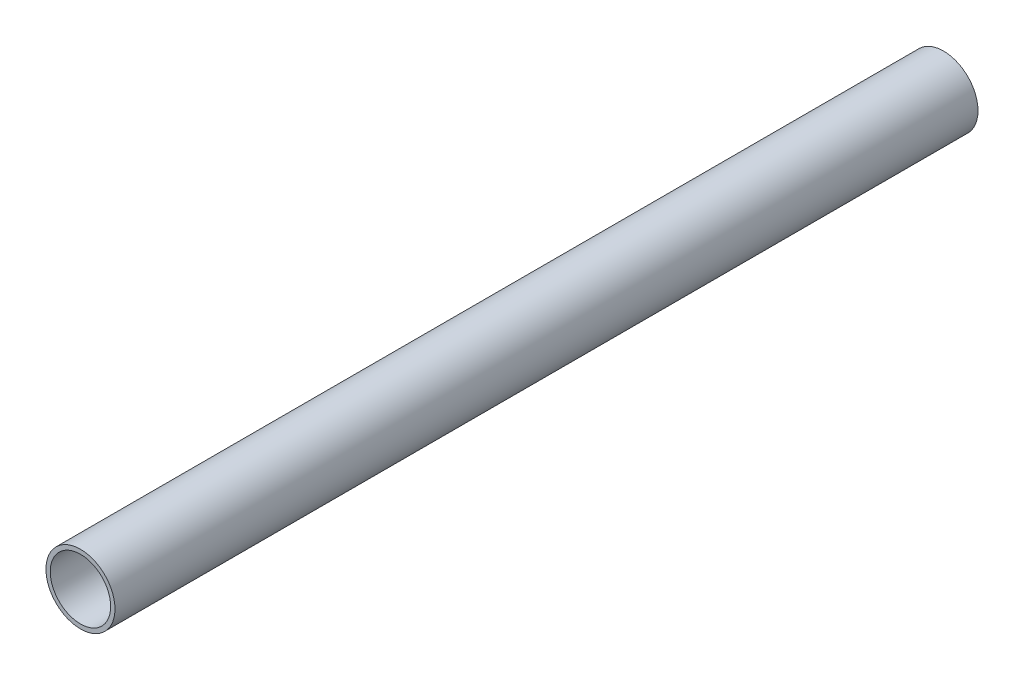
from build123d import *

# Parameters (mm, degrees)
SKETCH1_R           = 8
SKETCH1_R_2         = 7
BOSS_EXTRUDE1_DEPTH = 100


with BuildPart() as part:
    # Sketch1 → Boss-Extrude1 (new, symmetric)
    with BuildSketch(Plane.XY):
        Circle(SKETCH1_R)
        Circle(SKETCH1_R_2, mode=Mode.SUBTRACT)
    extrude(amount=BOSS_EXTRUDE1_DEPTH, both=True)


solid = part.part
